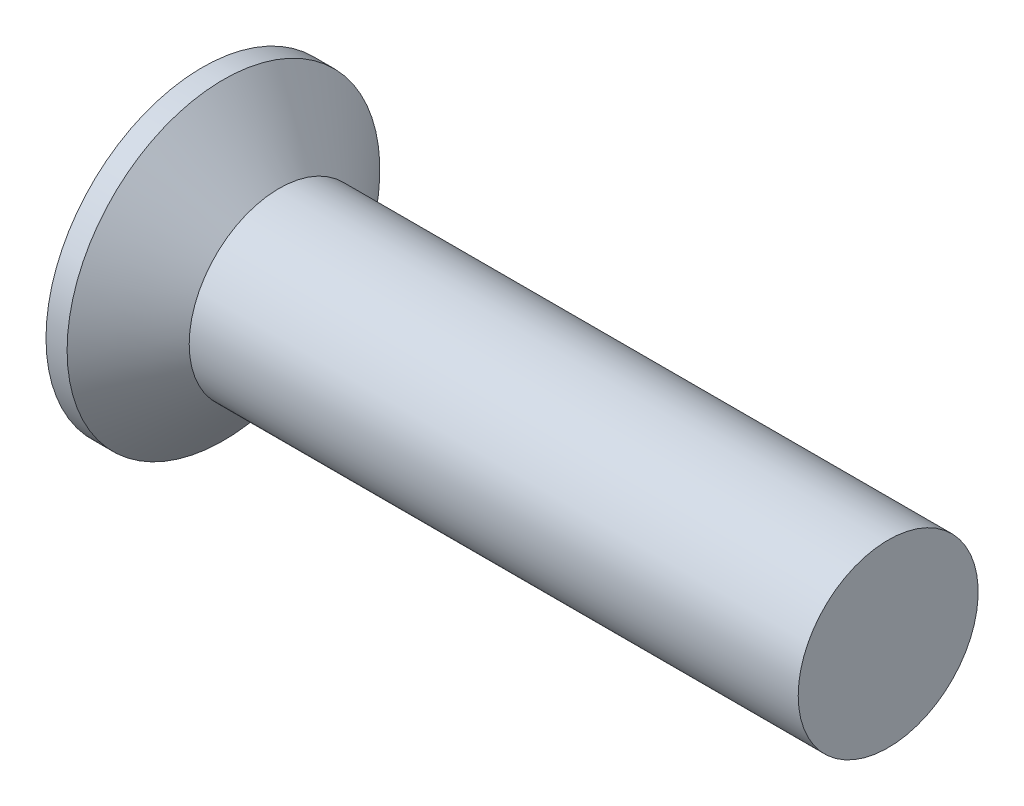
from build123d import *

# Parameters (mm, degrees)
CIRPATTERN1_COUNT = 2
CIRPATTERN1_ANGLE = 90


with BuildPart() as part:
    # BodySke → Base-Revolve (revolve)
    with BuildSketch(Plane.XY, mode=Mode.PRIVATE) as base_revolve_sk:
        Polygon((0, 0), (0, 3.6195), (0.488555597, 3.6195), (1.778, 2.0828), (15.875, 2.0828), (15.875, 0), align=None)
    revolve(base_revolve_sk.sketch.rotate(Axis((-6.35, 0, 0), (1, 0, 0)), 90), axis=Axis((-6.35, 0, 0), (1, 0, 0)))

    # Sketch3 → Cross section 0
    with BuildSketch(Plane.ZY):
        with BuildLine():
            Line((-0.4699, 2.4257), (0.4699, 2.4257))
            Line((0.4699, 2.4257), (0.4699, -2.4257))
            Line((0.4699, -2.4257), (-0.4699, -2.4257))
            Line((-0.4699, -2.4257), (-0.4699, 2.4257))
        make_face()
    # Sketch4 → Cross section 1
    with BuildSketch(Plane.ZY.offset(-3.1496)):
        with BuildLine():
            Line((-0.23495, 0.23495), (0.23495, 0.23495))
            Line((0.23495, 0.23495), (0.23495, -0.23495))
            Line((0.23495, -0.23495), (-0.23495, -0.23495))
            Line((-0.23495, -0.23495), (-0.23495, 0.23495))
        make_face()
    cross = loft(mode=Mode.SUBTRACT)

    # CirPattern1: Cross ×2 about axis
    cirpattern1_axis = Axis((0, 0, 0), (1, 0, 0))
    for i in range(1, CIRPATTERN1_COUNT):
        add(cross.rotate(cirpattern1_axis, i * CIRPATTERN1_ANGLE / (CIRPATTERN1_COUNT - 1)), mode=Mode.SUBTRACT)


solid = part.part
